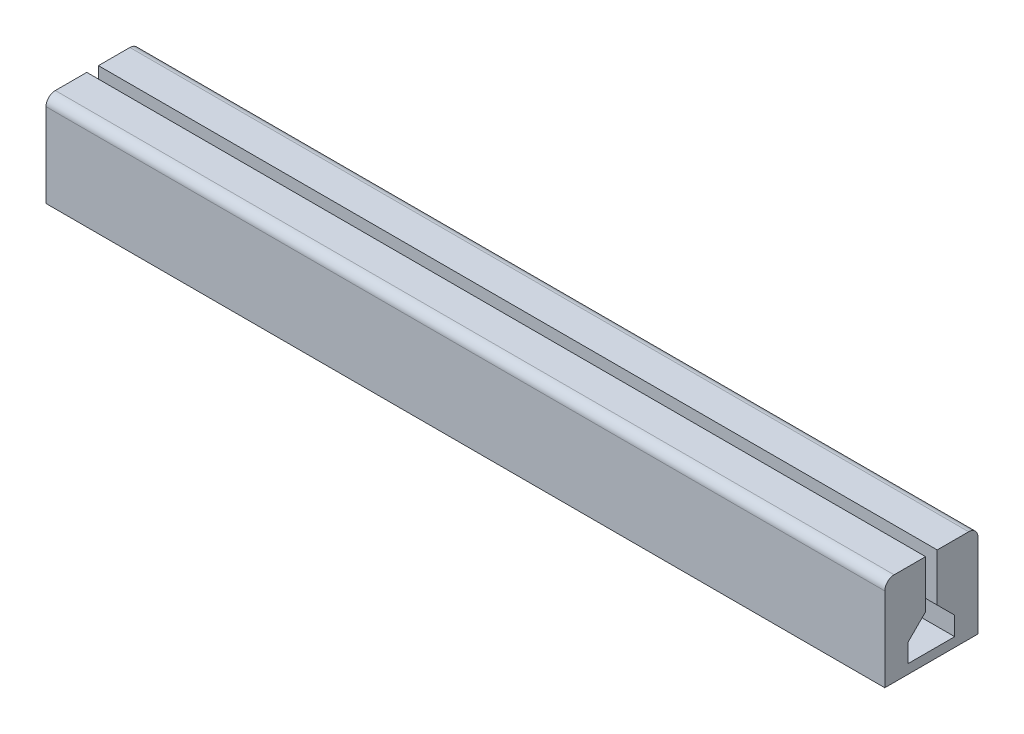
from build123d import *

# Parameters (mm, degrees)
BOSS_EXTRUDE1_DEPTH = 114.3
CUT_EXTRUDE2_DEPTH  = 114.3


with BuildPart() as part:
    # Sketch1 → Boss-Extrude1 (new, symmetric)
    with BuildSketch(Plane(origin=(0, 0, 0), x_dir=(0, 0, -1), z_dir=(1, 0, 0))):
        with BuildLine():
            Line((12.7, 0), (-12.7, 0))
            Line((-12.7, 0), (-12.7, 22.86))
            ThreePointArc((-12.7, 22.86), (-11.956051224, 24.656051224), (-10.16, 25.4))
            Line((-10.16, 25.4), (-1.5875, 25.4))
            Line((-1.5875, 25.4), (-1.5875, 7.62))
            Line((-1.5875, 7.62), (-6.35, 7.62))
            Line((-6.35, 7.62), (-6.35, 2.54))
            Line((-6.35, 2.54), (6.35, 2.54))
            Line((6.35, 2.54), (6.35, 7.62))
            Line((6.35, 7.62), (1.5875, 7.62))
            Line((1.5875, 7.62), (1.5875, 25.4))
            Line((1.5875, 25.4), (10.16, 25.4))
            ThreePointArc((10.16, 25.4), (11.956051224, 24.656051224), (12.7, 22.86))
            Line((12.7, 22.86), (12.7, 0))
        make_face()
    extrude(amount=BOSS_EXTRUDE1_DEPTH, both=True)

    # Sketch2 → Cut-Extrude2 (cut, symmetric)
    with BuildSketch(Plane(origin=(0, 0, 0), x_dir=(0, 0, -1), z_dir=(1, 0, 0))):
        Polygon((-6.35, 7.62), (-1.5875, 12.3825), (-1.5875, 7.62), align=None)
        Polygon((1.5875, 7.62), (6.35, 7.62), (1.5875, 12.3825), align=None)
    extrude(amount=CUT_EXTRUDE2_DEPTH, both=True, mode=Mode.SUBTRACT)


solid = part.part
